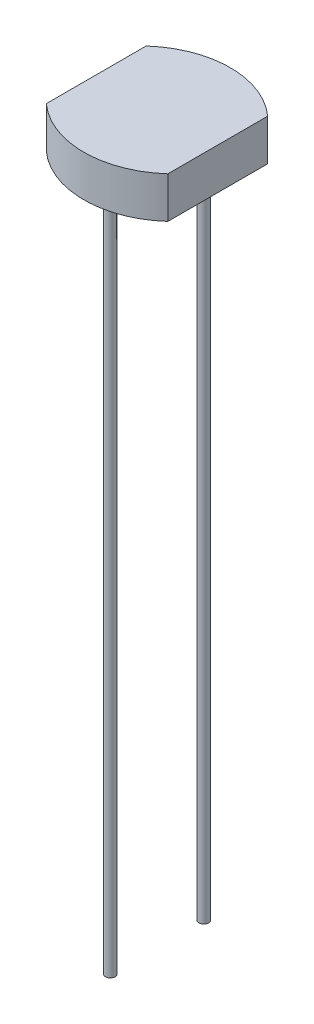
from build123d import *

# Parameters (mm, degrees)
BOSS_EXTRUDE1_DEPTH = 1.9
SKETCH2_R           = 0.225
BOSS_EXTRUDE2_DEPTH = 31.5


with BuildPart() as part:
    # Sketch1 → Boss-Extrude1 (new body)
    with BuildSketch(Plane(origin=(0, 0, 0), x_dir=(1, 0, 0), z_dir=(0, 1, 0))):
        with BuildLine():
            Line((-2.8, 2.298937026), (-2.8, 0))
            Line((-2.8, 0), (2.8, 0))
            Line((2.8, 0), (2.8, 2.298937026))
            ThreePointArc((2.8, 2.298937026), (1.49982595, 3.096723441), (0, 3.375))
            ThreePointArc((0, 3.375), (-1.49982595, 3.096723441), (-2.8, 2.298937026))
        make_face()
    boss_extrude1 = extrude(amount=BOSS_EXTRUDE1_DEPTH)

    # Sketch2 → Boss-Extrude2 (add)
    with BuildSketch(Plane.XZ):
        with Locations(Location((0, -2.15, 0), (0, 0, 90))):
            Circle(SKETCH2_R)
    boss_extrude2 = extrude(amount=BOSS_EXTRUDE2_DEPTH)

    # Mirror2: Boss-Extrude1, Boss-Extrude2 across plane
    add(boss_extrude1.mirror(Plane.XY))
    add(boss_extrude2.mirror(Plane.XY))


solid = part.part
